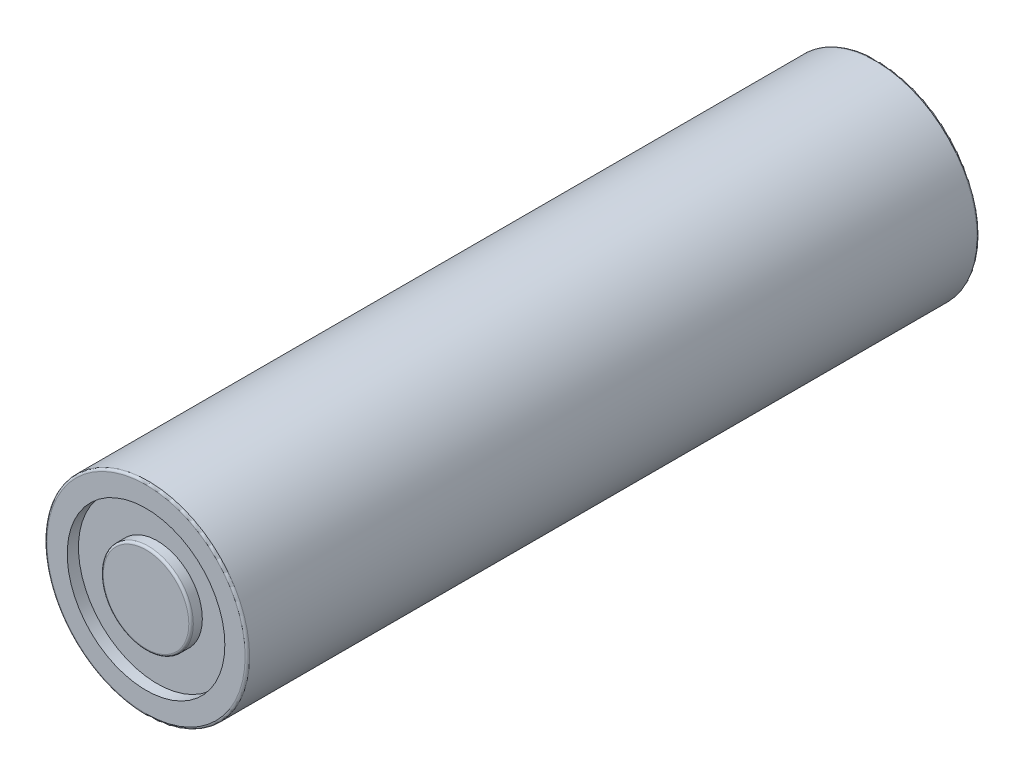
from build123d import *

# Parameters (mm, degrees)
SKETCH1_R           = 9
BOSS_EXTRUDE1_DEPTH = 32.5
SKETCH2_R           = 7
SKETCH2_R_2         = 4
CUT_EXTRUDE1_DEPTH  = 1
FILLET1_R           = 0.2


with BuildPart() as part:
    # Sketch1 → Boss-Extrude1 (new, symmetric)
    with BuildSketch(Plane.XY):
        Circle(SKETCH1_R)
    extrude(amount=BOSS_EXTRUDE1_DEPTH, both=True)

    # Sketch2 → Cut-Extrude1 (cut)
    with BuildSketch(Plane.XY.offset(32.5)):
        Circle(SKETCH2_R)
        Circle(SKETCH2_R_2, mode=Mode.SUBTRACT)
    extrude(amount=-CUT_EXTRUDE1_DEPTH, mode=Mode.SUBTRACT)

    # Fillet1
    fillet1_edges = [part.edges().sort_by_distance(p)[0] for p in [
        (-4, 0, 32.5),
        (-9, 0, -32.5),
        (-9, 0, 32.5),
    ]]
    fillet(fillet1_edges, radius=FILLET1_R)


solid = part.part
